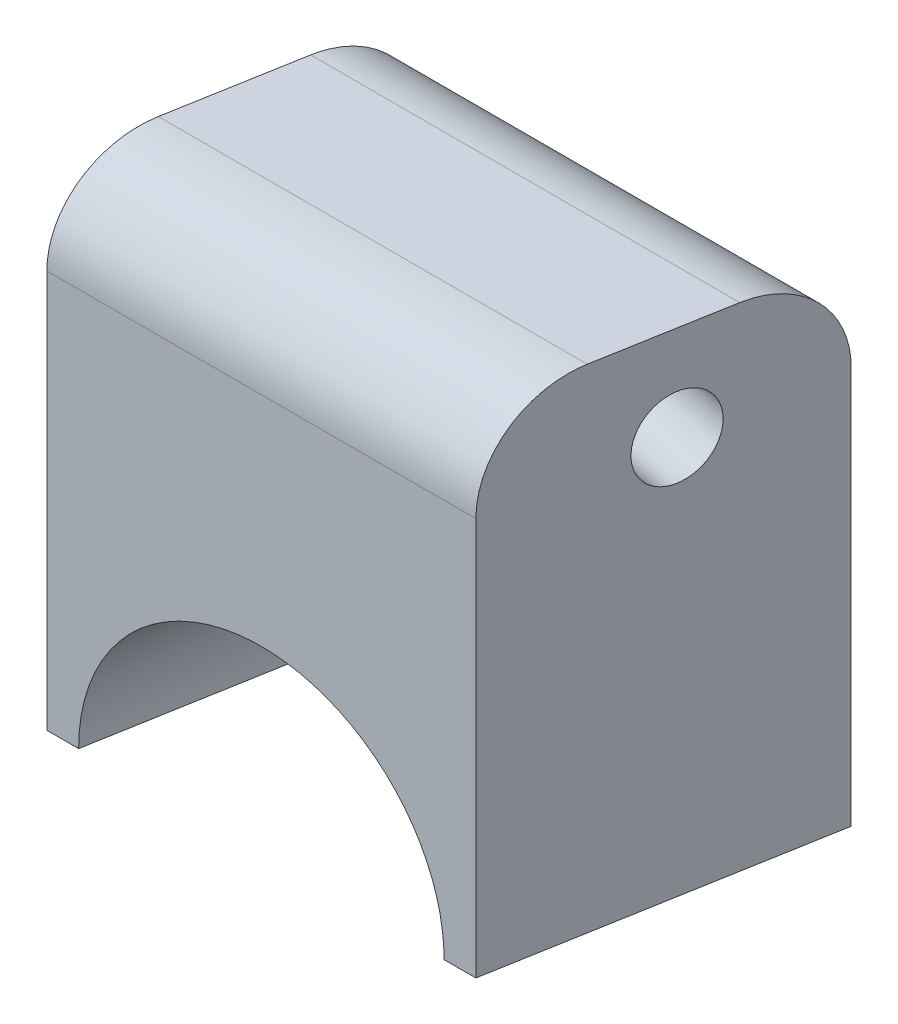
from build123d import *

# Parameters (mm, degrees)
BOSS_EXTRUDE2_DEPTH             = 26
CUT_EXTRUDE7_DEPTH              = 71.182431461
CUT_EXTRUDE8_DEPTH              = 59.485252348
FILLET6_R                       = 5
M5_TAPPED_HOLE1_D               = 4.2
M5_TAPPED_HOLE1_DEPTH           = 4.7381927
M5_TAPPED_HOLE1_TIP             = 1.2618073
M5_TAPPED_HOLE1_ON_FACE_2_D     = 4.2
M5_TAPPED_HOLE1_ON_FACE_2_DEPTH = 4.7381927
M5_TAPPED_HOLE1_ON_FACE_2_TIP   = 1.2618073


with BuildPart() as part:
    # 草图1 → Boss-Extrude2 (new body)
    with BuildSketch(Plane(origin=(0, 0, 0), x_dir=(1, 0, 0), z_dir=(0, 1, 0))):
        Polygon((29.300589914, 18.286975519), (51.945589914, 18.286975519), (54.914973752, 35.127188096), (32.269973752, 35.127188096), align=None)
        Polygon((29.300589914, 18.286975519), (51.945589914, 18.286975519), (51.262759613, 14.414452446), align=None)
    extrude(amount=BOSS_EXTRUDE2_DEPTH)

    # Sketch3 → Cut-Extrude7 (cut, through all)
    with BuildSketch(Plane(origin=(0, 26, 0), x_dir=(1, 0, 0), z_dir=(0, 1, 0))):
        Polygon((29.300589914, 18.286975519), (51.945589914, 18.286975519), (51.262759613, 14.414452446), align=None)
    extrude(amount=-CUT_EXTRUDE7_DEPTH, mode=Mode.SUBTRACT)

    # Sketch2 → Cut-Extrude8 (cut, through all)
    with BuildSketch(Plane(origin=(4.010777888, 0, -22.746251717), x_dir=(0.984807753012208, 0, 0.17364817766693091), z_dir=(-0.17364817766693091, 0, 0.984807753012208))):
        with BuildLine():
            Line((27.330433925, 0), (46.330433925, 0))
            ThreePointArc((46.330433925, 0), (36.830433925, 9.5), (27.330433925, 0))
        make_face()
    extrude(amount=-CUT_EXTRUDE8_DEPTH, mode=Mode.SUBTRACT)

    # Fillet6
    fillet6_edges = [part.edges().sort_by_distance(p)[0] for p in [
        (40.623089914, 26, -18.286975519),
        (43.592473752, 26, -35.127188096),
    ]]
    fillet(fillet6_edges, radius=FILLET6_R)

    # M5 Tapped Hole1
    with Locations(Plane(origin=(53.537445864, 21, -27.314839229), x_dir=(-0.173648177667, 0, 0.984807753012), z_dir=(0.984807753012, 0, 0.173648177667))):
        with Locations((0, 0)):
            Hole(M5_TAPPED_HOLE1_D / 2, depth=M5_TAPPED_HOLE1_DEPTH)
            with Locations((0, 0, -(M5_TAPPED_HOLE1_DEPTH + M5_TAPPED_HOLE1_TIP / 2))):  # 118° drill point
                Cone(0, M5_TAPPED_HOLE1_D / 2, M5_TAPPED_HOLE1_TIP, mode=Mode.SUBTRACT)

    # M5 Tapped Hole1 on face 2
    with Locations(Plane(origin=(30.701085573, 21, -26.229581085), x_dir=(0.17364796312, 0, -0.984807790843), z_dir=(-0.984807790843, 0, -0.17364796312))):
        with Locations((0, 0)):
            Hole(M5_TAPPED_HOLE1_ON_FACE_2_D / 2, depth=M5_TAPPED_HOLE1_ON_FACE_2_DEPTH)
            with Locations((0, 0, -(M5_TAPPED_HOLE1_ON_FACE_2_DEPTH + M5_TAPPED_HOLE1_ON_FACE_2_TIP / 2))):  # 118° drill point
                Cone(0, M5_TAPPED_HOLE1_ON_FACE_2_D / 2, M5_TAPPED_HOLE1_ON_FACE_2_TIP, mode=Mode.SUBTRACT)


solid = part.part
